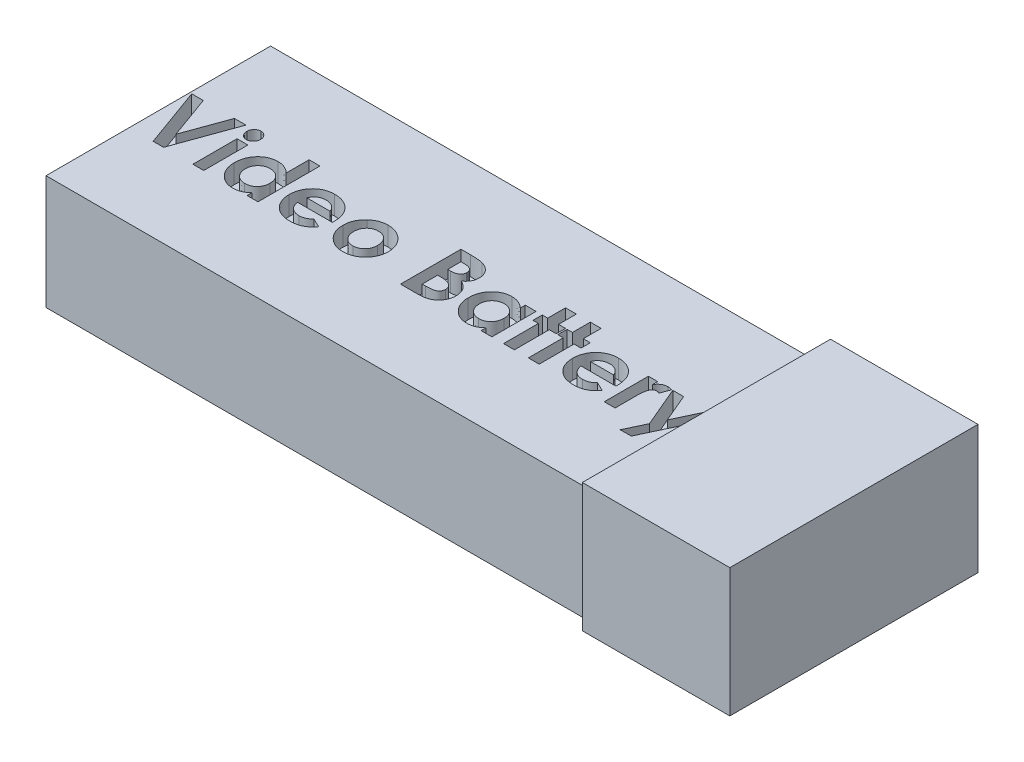
from build123d import *

# Parameters (mm, degrees)
SKETCH1_W           = 28.8
SKETCH1_H           = 11.8
BOSS_EXTRUDE1_DEPTH = 6
SKETCH3_W           = 13.04
SKETCH3_H           = 6.75
BOSS_EXTRUDE2_DEPTH = 7.75
SKETCH4_W           = 0.569871795
SKETCH4_H           = 2.320192307
CUT_EXTRUDE1_DEPTH  = 1


with BuildPart() as part:
    # Sketch1 → Boss-Extrude1 (new body)
    with BuildSketch(Plane(origin=(0, 0, 0), x_dir=(1, 0, 0), z_dir=(0, 1, 0))):
        with Locations((-14.4, 5.9)):
            Rectangle(SKETCH1_W, SKETCH1_H)
    extrude(amount=BOSS_EXTRUDE1_DEPTH)

    # Sketch3 → Boss-Extrude2 (add)
    with BuildSketch(Plane(origin=(0, 0, 0), x_dir=(0, 0, -1), z_dir=(1, 0, 0))):
        with Locations((5.9, 3.375)):
            Rectangle(SKETCH3_W, SKETCH3_H)
    extrude(amount=BOSS_EXTRUDE2_DEPTH)

    # Sketch4 → Cut-Extrude1 (cut)
    # profile 1 of 13: a face of its own
    with BuildSketch(Plane(origin=(0, 6, 0), x_dir=(1, 0, 0), z_dir=(0, 1, 0))):
        Polygon((-28.698237179, 7.554953492), (-28.089568309, 7.554953492), (-27.273557692, 5.299634982), (-26.455639022, 7.554953492), (-25.848878205, 7.554953492), (-27.000070112, 4.379953492), (-27.548953325, 4.379953492), align=None)
    # profile 2 of 13: a face of its own
    with BuildSketch(Plane(origin=(0, 6, 0), x_dir=(1, 0, 0), z_dir=(0, 1, 0))):
        with BuildLine():
            add(Edge.make_bspline(
                [(-25.178515625, 7.677068876), (-25.153954155, 7.675863798), (-25.105725341, 7.67349751), (-25.036631003, 7.650431464), (-24.973216404, 7.614229995), (-24.917156139, 7.564560717), (-24.870530453, 7.505246514), (-24.834906697, 7.43884032), (-24.815062187, 7.365264396), (-24.812306078, 7.314438917), (-24.810897436, 7.288462106)],
                knots=[0, 0, 0, 0, 0.989868614, 1.943702388, 2.910836514, 3.924849579, 4.949916355, 5.946401046, 6.950409252, 8, 8, 8, 8], degree=3))
            add(Edge.make_bspline(
                [(-24.810897436, 7.288462106), (-24.812255679, 7.262676729), (-24.814902282, 7.212432695), (-24.835363431, 7.139855599), (-24.869557373, 7.073481658), (-24.916560698, 7.015048381), (-24.972013196, 6.966179056), (-25.034042138, 6.929320371), (-25.102474352, 6.907537484), (-25.1499548, 6.904973388), (-25.174063502, 6.903671441)],
                knots=[0, 0, 0, 0, 1.05296456, 2.051751585, 3.055639087, 4.085634717, 5.099016424, 6.062201612, 7.016062274, 8, 8, 8, 8], degree=3))
            add(Edge.make_bspline(
                [(-25.174063502, 6.903671441), (-25.198839373, 6.904872211), (-25.247487775, 6.907229972), (-25.317148829, 6.930349987), (-25.381409218, 6.966266346), (-25.437226293, 7.016950444), (-25.484385947, 7.07668612), (-25.518453643, 7.144638307), (-25.53976383, 7.218717342), (-25.54229333, 7.270295581), (-25.543589744, 7.296730335)],
                knots=[0, 0, 0, 0, 0.989065327, 1.942068821, 2.907541208, 3.917690034, 4.939857478, 5.938239964, 6.943311734, 8, 8, 8, 8], degree=3))
            add(Edge.make_bspline(
                [(-25.543589744, 7.296730335), (-25.542178891, 7.32207786), (-25.539407476, 7.371869414), (-25.519444095, 7.44380953), (-25.484637191, 7.509099332), (-25.438347354, 7.567327733), (-25.382779487, 7.616070493), (-25.319402957, 7.651172499), (-25.250773626, 7.673285851), (-25.202850325, 7.675794848), (-25.178515625, 7.677068876)],
                knots=[0, 0, 0, 0, 1.038616768, 2.040212704, 3.031499824, 4.052181184, 5.074969369, 6.039807101, 7.004644834, 8, 8, 8, 8], degree=3))
        make_face()
    # profile 3 of 13: a face of its own
    with BuildSketch(Plane(origin=(0, 6, 0), x_dir=(1, 0, 0), z_dir=(0, 1, 0))):
        with Locations((-25.17724359, 5.540049645)):
            Rectangle(SKETCH4_W, SKETCH4_H)
    # profile 4 of 13: a face of its own
    with BuildSketch(Plane(origin=(0, 6, 0), x_dir=(1, 0, 0), z_dir=(0, 1, 0))):
        with BuildLine():
            Line((-22.612820513, 7.636363748), (-22.042948718, 7.636363748))
            Line((-22.042948718, 7.636363748), (-22.042948718, 4.379953492))
            Line((-22.042948718, 4.379953492), (-22.612820513, 4.379953492))
            Line((-22.612820513, 4.379953492), (-22.612820513, 4.633088508))
            add(Edge.make_bspline(
                [(-22.612820513, 4.633088508), (-22.64105745, 4.608448616), (-22.69585977, 4.560627451), (-22.782210492, 4.498578273), (-22.868813541, 4.447395722), (-22.956085047, 4.40663161), (-23.045366336, 4.37653151), (-23.137300198, 4.354738334), (-23.233210579, 4.341886365), (-23.298409134, 4.340136857), (-23.331520433, 4.339248364)],
                knots=[0, 0, 0, 0, 1.129196829, 2.191548051, 3.199897424, 4.157751732, 5.089409408, 6.034969131, 7.002052659, 8, 8, 8, 8], degree=3))
            add(Edge.make_bspline(
                [(-23.331520433, 4.339248364), (-23.368689338, 4.340084548), (-23.442137201, 4.341736895), (-23.549913786, 4.359130515), (-23.653982793, 4.385755328), (-23.754259748, 4.423432765), (-23.850562206, 4.472255338), (-23.943627172, 4.530949196), (-24.03185923, 4.601574846), (-24.115992881, 4.681076496), (-24.193025147, 4.768528876), (-24.260367481, 4.862718159), (-24.317132064, 4.96230848), (-24.36363625, 5.066969649), (-24.400217797, 5.176624851), (-24.426295205, 5.29162188), (-24.441680906, 5.412001806), (-24.443585223, 5.493999897), (-24.444551282, 5.535597522)],
                knots=[0, 0, 0, 0, 0.980476535, 1.937477201, 2.874147792, 3.812856188, 4.758993464, 5.720109578, 6.712210464, 7.737600662, 8.772720504, 9.783789959, 10.789002326, 11.793715968, 12.802552247, 13.835794126, 14.902098527, 16, 16, 16, 16], degree=3))
            add(Edge.make_bspline(
                [(-24.444551282, 5.535597522), (-24.443537399, 5.578671918), (-24.441548554, 5.663167145), (-24.427000275, 5.787159873), (-24.401404093, 5.905008243), (-24.366501859, 6.016875493), (-24.321606195, 6.12278095), (-24.266926275, 6.222898119), (-24.201718232, 6.316965311), (-24.126577522, 6.403381436), (-24.045444011, 6.482585989), (-23.958645497, 6.551539833), (-23.867539319, 6.610119333), (-23.772028661, 6.657942937), (-23.672127163, 6.694898598), (-23.568229234, 6.721916204), (-23.45987364, 6.738127716), (-23.386060931, 6.739935652), (-23.348692909, 6.740850928)],
                knots=[0, 0, 0, 0, 1.136281865, 2.228943489, 3.287578264, 4.313574083, 5.316051562, 6.317280042, 7.318008486, 8.329309503, 9.333984563, 10.305318864, 11.248632312, 12.186624717, 13.117503092, 14.05354244, 15.014596925, 16, 16, 16, 16], degree=3))
            add(Edge.make_bspline(
                [(-23.348692909, 6.740850928), (-23.314100327, 6.739753415), (-23.245693497, 6.737583083), (-23.144644824, 6.723921385), (-23.047416811, 6.698197599), (-22.952828624, 6.665054393), (-22.862108674, 6.620454941), (-22.774769563, 6.566880323), (-22.690581167, 6.503650155), (-22.639068416, 6.454753301), (-22.612820513, 6.429838307)],
                knots=[0, 0, 0, 0, 1.011899165, 2.001030639, 2.974036179, 3.948778736, 4.92769327, 5.924124564, 6.942254589, 8, 8, 8, 8], degree=3))
            Line((-22.612820513, 6.429838307), (-22.612820513, 7.636363748))
        make_face()
        with BuildLine():
            add(Edge.make_bspline(
                [(-23.229121595, 6.211684261), (-23.251829306, 6.21098751), (-23.296334937, 6.209621924), (-23.361786558, 6.201407826), (-23.424338673, 6.186934221), (-23.483545166, 6.165552576), (-23.54028843, 6.139506618), (-23.59370681, 6.106884485), (-23.644241184, 6.068325816), (-23.691594355, 6.024764117), (-23.734763747, 5.976881845), (-23.771978282, 5.924631912), (-23.803604625, 5.869422156), (-23.830352292, 5.811086582), (-23.849497552, 5.748934898), (-23.864660591, 5.68377621), (-23.872529226, 5.615078204), (-23.873955562, 5.568262638), (-23.874679487, 5.544501769)],
                knots=[0, 0, 0, 0, 1.04836806, 2.054732945, 3.03993516, 4.00574415, 4.955904794, 5.917688631, 6.888591924, 7.88601754, 8.884115178, 9.859153345, 10.841239365, 11.818093293, 12.814750328, 13.83810466, 14.90274714, 16, 16, 16, 16], degree=3))
            add(Edge.make_bspline(
                [(-23.874679487, 5.544501769), (-23.87396662, 5.520525375), (-23.872561924, 5.473280168), (-23.864533363, 5.404002669), (-23.849915953, 5.337892166), (-23.828589703, 5.275483115), (-23.802545405, 5.215933413), (-23.770843638, 5.159517888), (-23.731903569, 5.107234036), (-23.688696335, 5.057844646), (-23.640371721, 5.013741837), (-23.589551403, 4.974582593), (-23.535541215, 4.941818077), (-23.478927128, 4.915337589), (-23.41989971, 4.893758217), (-23.357718934, 4.879466515), (-23.29299394, 4.8703301), (-23.248869203, 4.869057795), (-23.226577524, 4.86841503)],
                knots=[0, 0, 0, 0, 1.099136573, 2.165835871, 3.191374663, 4.196217796, 5.183857741, 6.167377911, 7.154730987, 8.166690795, 9.170734848, 10.148332609, 11.103258353, 12.059567475, 13.009337315, 13.978056681, 14.978520572, 16, 16, 16, 16], degree=3))
            add(Edge.make_bspline(
                [(-23.226577524, 4.86841503), (-23.203446855, 4.869115687), (-23.15809817, 4.870489356), (-23.091578739, 4.878628491), (-23.028186324, 4.893155165), (-22.968184673, 4.914659224), (-22.910657317, 4.940518224), (-22.856123389, 4.972502896), (-22.805174664, 5.010973084), (-22.75755311, 5.054928582), (-22.713917136, 5.103201841), (-22.676187953, 5.156136949), (-22.643324454, 5.212040895), (-22.617478825, 5.272235453), (-22.59695377, 5.335667499), (-22.582227517, 5.402730705), (-22.574217289, 5.473497374), (-22.572824878, 5.521798383), (-22.572115385, 5.546409822)],
                knots=[0, 0, 0, 0, 1.050008698, 2.058587853, 3.036635738, 3.995319155, 4.947022481, 5.895997462, 6.858296291, 7.838991643, 8.833936038, 9.806048392, 10.784806122, 11.771666913, 12.772873988, 13.80724452, 14.882696879, 16, 16, 16, 16], degree=3))
            add(Edge.make_bspline(
                [(-22.572115385, 5.546409822), (-22.572816062, 5.570597956), (-22.574184688, 5.617844408), (-22.582262063, 5.687133502), (-22.597092864, 5.752879893), (-22.617195479, 5.815204432), (-22.643500911, 5.873964612), (-22.676389275, 5.928508926), (-22.71370459, 5.980727128), (-22.757823677, 6.02769626), (-22.805187254, 6.071333486), (-22.856885263, 6.108640307), (-22.911288935, 6.14079236), (-22.968732528, 6.167190436), (-23.029747944, 6.186541226), (-23.093248692, 6.201523835), (-23.160225516, 6.209616994), (-23.205781466, 6.210983927), (-23.229121595, 6.211684261)],
                knots=[0, 0, 0, 0, 1.106611376, 2.161533483, 3.185006901, 4.184773755, 5.152708835, 6.122342771, 7.094156588, 8.082475533, 9.064254463, 10.03606828, 10.992420271, 11.951521816, 12.920622147, 13.915721683, 14.932141191, 16, 16, 16, 16], degree=3))
        make_face(mode=Mode.SUBTRACT)
    # profile 5 of 13: a face of its own
    with BuildSketch(Plane(origin=(0, 6, 0), x_dir=(1, 0, 0), z_dir=(0, 1, 0))):
        with BuildLine():
            Line((-19.154792668, 5.397581697), (-20.984615385, 5.397581697))
            add(Edge.make_bspline(
                [(-20.984615385, 5.397581697), (-20.980884524, 5.376320195), (-20.973553088, 5.334539666), (-20.957632615, 5.273849823), (-20.937315703, 5.216656739), (-20.912967164, 5.162883962), (-20.884997513, 5.112247215), (-20.852373233, 5.064984004), (-20.815508132, 5.021136077), (-20.774615356, 4.980894), (-20.730376511, 4.944836227), (-20.683006141, 4.913247338), (-20.632455362, 4.887346382), (-20.579303719, 4.865514563), (-20.523154048, 4.848221551), (-20.463923711, 4.83629489), (-20.401769717, 4.829249767), (-20.359428518, 4.828230771), (-20.337785457, 4.827709902)],
                knots=[0, 0, 0, 0, 1.091296461, 2.144483647, 3.168565212, 4.157007626, 5.126487748, 6.090021542, 7.05641414, 8.019231907, 8.98705074, 9.938580405, 10.892824166, 11.854447369, 12.841318655, 13.858982407, 14.905600794, 16, 16, 16, 16], degree=3))
            add(Edge.make_bspline(
                [(-20.337785457, 4.827709902), (-20.311660813, 4.828399618), (-20.260213695, 4.829757872), (-20.184843284, 4.841803564), (-20.111949118, 4.859998052), (-20.042221032, 4.887054784), (-19.974851336, 4.920735659), (-19.910949142, 4.962697884), (-19.849408353, 5.011715187), (-19.811861219, 5.049497706), (-19.792718349, 5.068760583)],
                knots=[0, 0, 0, 0, 1.021034703, 2.010718019, 2.977989445, 3.954245119, 4.929443971, 5.918328161, 6.938689359, 8, 8, 8, 8], degree=3))
            Line((-19.792718349, 5.068760583), (-19.315705128, 4.84170229))
            add(Edge.make_bspline(
                [(-19.315705128, 4.84170229), (-19.330723611, 4.820949052), (-19.360482183, 4.779827273), (-19.409062052, 4.72195831), (-19.459758239, 4.66796422), (-19.512608553, 4.61820013), (-19.567680021, 4.572807849), (-19.624819448, 4.531234415), (-19.684861902, 4.49459606), (-19.746606847, 4.461120242), (-19.811330665, 4.432421578), (-19.878854235, 4.40794837), (-19.948891558, 4.385824799), (-20.022327053, 4.36896785), (-20.098549225, 4.355624026), (-20.177740411, 4.346148143), (-20.259890175, 4.340295345), (-20.315726891, 4.339601503), (-20.344145633, 4.339248364)],
                knots=[0, 0, 0, 0, 1.028154879, 2.037251081, 3.030720504, 4.000128189, 4.949298328, 5.894184978, 6.834267904, 7.770992897, 8.712077017, 9.673380525, 10.653304757, 11.658697181, 12.695551717, 13.758623199, 14.859225354, 16, 16, 16, 16], degree=3))
            add(Edge.make_bspline(
                [(-20.344145633, 4.339248364), (-20.387867401, 4.340139719), (-20.473493965, 4.341885387), (-20.598738292, 4.358087684), (-20.717685666, 4.38495284), (-20.830671951, 4.421471893), (-20.937208746, 4.469688484), (-21.037348776, 4.528661374), (-21.132092584, 4.597259935), (-21.218545216, 4.676923869), (-21.297306114, 4.763633325), (-21.36648479, 4.856753359), (-21.424372521, 4.955633377), (-21.47191109, 5.059618971), (-21.508859718, 5.168976303), (-21.535497535, 5.283753094), (-21.551826836, 5.403894525), (-21.553590481, 5.48572425), (-21.554487179, 5.527329293)],
                knots=[0, 0, 0, 0, 1.103565453, 2.161269334, 3.182010356, 4.179077853, 5.15417608, 6.128274628, 7.109042802, 8.101804412, 9.090965879, 10.063106201, 11.02526161, 11.978650795, 12.945248442, 13.93468508, 14.949922959, 16, 16, 16, 16], degree=3))
            add(Edge.make_bspline(
                [(-21.554487179, 5.527329293), (-21.553581656, 5.569991574), (-21.551800079, 5.653927694), (-21.53563813, 5.776843246), (-21.508786073, 5.894121307), (-21.471729363, 6.005923381), (-21.42491196, 6.112599139), (-21.366287707, 6.213215295), (-21.297340444, 6.308122139), (-21.21886328, 6.396875688), (-21.132044408, 6.476985462), (-21.039791154, 6.548379281), (-20.941066958, 6.607869349), (-20.836988476, 6.655937287), (-20.728221431, 6.694991274), (-20.613508629, 6.72097844), (-20.493722859, 6.738427267), (-20.411839944, 6.740034195), (-20.370222356, 6.740850928)],
                knots=[0, 0, 0, 0, 1.079208495, 2.12329425, 3.130605359, 4.119693003, 5.099659317, 6.073216462, 7.060498243, 8.06384408, 9.066070512, 10.045757761, 11.010926815, 11.975797609, 12.942977511, 13.929384301, 14.947594487, 16, 16, 16, 16], degree=3))
            add(Edge.make_bspline(
                [(-20.370222356, 6.740850928), (-20.32629113, 6.739945744), (-20.240036697, 6.738168508), (-20.113920081, 6.722097769), (-19.994182911, 6.695068793), (-19.88031504, 6.658865514), (-19.773770607, 6.609430921), (-19.672208508, 6.55190926), (-19.578064778, 6.481827889), (-19.490335945, 6.402553805), (-19.411142744, 6.314601956), (-19.341919111, 6.219059311), (-19.28301832, 6.116858308), (-19.235278644, 6.007584503), (-19.198367956, 5.891565944), (-19.171705481, 5.768953306), (-19.155500733, 5.639280228), (-19.153769905, 5.55048564), (-19.152884615, 5.505068676)],
                knots=[0, 0, 0, 0, 1.080001299, 2.120471247, 3.119684163, 4.095710327, 5.052285597, 6.002875087, 6.961153713, 7.931888285, 8.906493152, 9.865905668, 10.82813294, 11.801621613, 12.7925306, 13.817193356, 14.883530496, 16, 16, 16, 16], degree=3))
            Line((-19.152884615, 5.505068676), (-19.154792668, 5.397581697))
        make_face()
        with BuildLine():
            add(Edge.make_bspline(
                [(-19.72275641, 5.845338107), (-19.73351024, 5.874358336), (-19.754891654, 5.932058112), (-19.803191378, 6.011669723), (-19.867283567, 6.080616611), (-19.941827381, 6.141655838), (-20.026998356, 6.191199088), (-20.120112605, 6.227070009), (-20.219993183, 6.248578664), (-20.288705638, 6.251101251), (-20.323793069, 6.252389389)],
                knots=[0, 0, 0, 0, 0.954238005, 1.897273737, 2.851915805, 3.847685534, 4.862635127, 5.880135777, 6.917509367, 8, 8, 8, 8], degree=3))
            add(Edge.make_bspline(
                [(-20.323793069, 6.252389389), (-20.362114256, 6.251151976), (-20.437024198, 6.248733091), (-20.545076688, 6.22300736), (-20.646999899, 6.184612476), (-20.707088047, 6.145026535), (-20.737204527, 6.125185864)],
                knots=[0, 0, 0, 0, 1.044195649, 2.041185066, 3.018232172, 4, 4, 4, 4], degree=3))
            add(Edge.make_bspline(
                [(-20.737204527, 6.125185864), (-20.755994962, 6.110074774), (-20.796055207, 6.077858702), (-20.848081563, 6.013590699), (-20.899327956, 5.935776574), (-20.928464356, 5.876671249), (-20.943910256, 5.845338107)],
                knots=[0, 0, 0, 0, 0.82159062, 1.751589201, 2.808063854, 4, 4, 4, 4], degree=3))
            Line((-20.943910256, 5.845338107), (-19.72275641, 5.845338107))
        make_face(mode=Mode.SUBTRACT)
    # profile 6 of 13: a face of its own
    with BuildSketch(Plane(origin=(0, 6, 0), x_dir=(1, 0, 0), z_dir=(0, 1, 0))):
        with BuildLine():
            add(Edge.make_bspline(
                [(-17.559024439, 6.740850928), (-17.532082001, 6.740371469), (-17.478723765, 6.739421922), (-17.399253338, 6.731517816), (-17.321172237, 6.718621941), (-17.244031663, 6.701924034), (-17.168547938, 6.678527769), (-17.094325159, 6.650467567), (-17.020699679, 6.618251173), (-16.94949887, 6.579902396), (-16.880208357, 6.53830965), (-16.814516827, 6.492429439), (-16.752969803, 6.442622135), (-16.694424762, 6.390042561), (-16.641609999, 6.332401573), (-16.591150365, 6.272476555), (-16.545772073, 6.208120605), (-16.503758311, 6.140901927), (-16.466353761, 6.071209234), (-16.433874788, 5.999527332), (-16.405686093, 5.926847276), (-16.38361491, 5.852283771), (-16.365342005, 5.776820038), (-16.353810503, 5.699531324), (-16.345612405, 5.621211579), (-16.344693138, 5.568480281), (-16.344230769, 5.541957699)],
                knots=[0, 0, 0, 0, 1.022364134, 2.024744242, 3.027414945, 4.024939316, 5.017584196, 6.023349371, 7.035562955, 8.064994934, 9.090267829, 10.101425541, 11.102933353, 12.093946398, 13.084502048, 14.067315274, 15.065326281, 16.070028806, 17.074376865, 18.064572984, 19.055292013, 20.030201733, 21.013838017, 21.999348303, 22.993720005, 24, 24, 24, 24], degree=3))
            add(Edge.make_bspline(
                [(-16.344230769, 5.541957699), (-16.344718723, 5.515227908), (-16.345688887, 5.462083026), (-16.353513906, 5.383026586), (-16.366459142, 5.30537442), (-16.383221137, 5.228669063), (-16.406529846, 5.153892036), (-16.433763585, 5.079941094), (-16.467194072, 5.007824217), (-16.504153938, 4.936754678), (-16.54643783, 4.868823836), (-16.591776843, 4.803823195), (-16.642025126, 4.743458025), (-16.694417093, 4.685856236), (-16.751437813, 4.632965662), (-16.812177128, 4.5839275), (-16.876109204, 4.538142239), (-16.943693781, 4.496684086), (-17.014065214, 4.460256285), (-17.0860367, 4.42741365), (-17.16002909, 4.400069812), (-17.235889253, 4.377771664), (-17.313663193, 4.360506767), (-17.393179208, 4.348778516), (-17.474266049, 4.340621654), (-17.52889917, 4.339709074), (-17.556480369, 4.339248364)],
                knots=[0, 0, 0, 0, 1.012026251, 2.012137606, 3.004615893, 3.992048833, 4.982446996, 5.968083444, 6.973977695, 7.990229942, 8.999482246, 10.001782172, 10.988562221, 11.971415814, 12.948383116, 13.930088534, 14.925840678, 15.924049238, 16.929462851, 17.924729459, 18.917889337, 19.913673841, 20.916777188, 21.931792057, 22.95587778, 24, 24, 24, 24], degree=3))
            add(Edge.make_bspline(
                [(-17.556480369, 4.339248364), (-17.596809706, 4.340432109), (-17.676299443, 4.34276529), (-17.793369034, 4.358746966), (-17.905834265, 4.386255621), (-18.013878397, 4.42460208), (-18.117641783, 4.473741638), (-18.216218858, 4.534559302), (-18.310590196, 4.605857749), (-18.399121214, 4.687034356), (-18.480227619, 4.776092445), (-18.551083823, 4.871161413), (-18.611246474, 4.970816335), (-18.660661443, 5.075170851), (-18.698799724, 5.18436806), (-18.726342069, 5.298081501), (-18.742343285, 5.416630804), (-18.744656732, 5.497176621), (-18.745833333, 5.538141593)],
                knots=[0, 0, 0, 0, 1.029999031, 2.030143771, 3.011211297, 3.982305373, 4.953580601, 5.938004764, 6.935448627, 7.970290061, 9.001484052, 10.007591832, 10.993831261, 11.969999897, 12.951306496, 13.942897864, 14.953773953, 16, 16, 16, 16], degree=3))
            add(Edge.make_bspline(
                [(-18.745833333, 5.538141593), (-18.744615701, 5.581883203), (-18.742222468, 5.667856462), (-18.723219145, 5.793809245), (-18.692872888, 5.914403066), (-18.649312748, 6.029300585), (-18.593668501, 6.138713715), (-18.525739486, 6.242411693), (-18.445189993, 6.340418006), (-18.383505211, 6.399695584), (-18.352138421, 6.429838307)],
                knots=[0, 0, 0, 0, 1.043912699, 2.05178951, 3.033892, 4.007821512, 4.978932272, 5.95884105, 6.962068106, 8, 8, 8, 8], degree=3))
            add(Edge.make_bspline(
                [(-18.352138421, 6.429838307), (-18.323356257, 6.454823234), (-18.266575005, 6.504113323), (-18.174324158, 6.56662972), (-18.0798697, 6.620624814), (-17.982079555, 6.665018824), (-17.880681108, 6.698491191), (-17.776193968, 6.722856079), (-17.668639863, 6.737821708), (-17.595748598, 6.739836056), (-17.559024439, 6.740850928)],
                knots=[0, 0, 0, 0, 1.048115528, 2.067714963, 3.060638214, 4.039924844, 5.017819947, 5.994373833, 6.98952318, 8, 8, 8, 8], degree=3))
        make_face()
        with BuildLine():
            add(Edge.make_bspline(
                [(-17.546304087, 6.211684261), (-17.568367959, 6.210950931), (-17.611800928, 6.209507363), (-17.675735401, 6.201760119), (-17.736205298, 6.185881476), (-17.794411665, 6.165688189), (-17.849324825, 6.138682513), (-17.902448655, 6.107079648), (-17.951020832, 6.067532551), (-17.997391919, 6.024152279), (-18.039486529, 5.975979651), (-18.075355135, 5.923495609), (-18.107404528, 5.868708083), (-18.131705958, 5.809611232), (-18.151817714, 5.747820345), (-18.16542911, 5.68233707), (-18.174901691, 5.61389289), (-18.175604896, 5.567008157), (-18.175961538, 5.543229734)],
                knots=[0, 0, 0, 0, 1.030650113, 2.02884584, 2.99876339, 3.944280128, 4.900564847, 5.851248946, 6.823638398, 7.81794922, 8.81432732, 9.802856497, 10.78262424, 11.771747962, 12.779760563, 13.812642396, 14.89064281, 16, 16, 16, 16], degree=3))
            add(Edge.make_bspline(
                [(-18.175961538, 5.543229734), (-18.175544218, 5.518612763), (-18.174728645, 5.470503623), (-18.166283216, 5.400257807), (-18.152356424, 5.333594994), (-18.132570819, 5.270618163), (-18.107687079, 5.210875274), (-18.077157615, 5.154701524), (-18.040660224, 5.102434666), (-17.999281041, 5.054139061), (-17.953972603, 5.010300606), (-17.904327159, 4.972680084), (-17.852423673, 4.939992844), (-17.797066007, 4.913739945), (-17.739040398, 4.893470577), (-17.678174593, 4.878546923), (-17.614148741, 4.870506782), (-17.570493229, 4.869121868), (-17.548212139, 4.86841503)],
                knots=[0, 0, 0, 0, 1.141730614, 2.231293227, 3.276944405, 4.297399982, 5.28939179, 6.275415646, 7.257752684, 8.24146775, 9.222424823, 10.176631434, 11.126518621, 12.063689483, 13.012557477, 13.974037417, 14.965980454, 16, 16, 16, 16], degree=3))
            add(Edge.make_bspline(
                [(-17.548212139, 4.86841503), (-17.525919906, 4.869041964), (-17.482214189, 4.870271117), (-17.418113151, 4.879475535), (-17.35693652, 4.893961476), (-17.298415327, 4.914405295), (-17.243022721, 4.941220123), (-17.190546655, 4.974063744), (-17.14052549, 5.012207533), (-17.094609008, 5.056873136), (-17.052105, 5.105319358), (-17.014831526, 5.157862129), (-16.983684406, 5.214035893), (-16.95813819, 5.273487203), (-16.938313797, 5.336134345), (-16.924617567, 5.402210168), (-16.915139922, 5.471509901), (-16.91445262, 5.519027876), (-16.914102564, 5.543229734)],
                knots=[0, 0, 0, 0, 1.031504075, 2.022346795, 2.991027682, 3.937587355, 4.885570121, 5.833146507, 6.798790848, 7.791235734, 8.792807298, 9.778388351, 10.766749885, 11.760164525, 12.768777521, 13.802286646, 14.880660483, 16, 16, 16, 16], degree=3))
            add(Edge.make_bspline(
                [(-16.914102564, 5.543229734), (-16.914525194, 5.567423133), (-16.91535453, 5.614898432), (-16.923800561, 5.684291891), (-16.937590678, 5.750154139), (-16.957631475, 5.81220395), (-16.982367309, 5.871149213), (-17.012917874, 5.92668821), (-17.049595259, 5.978547398), (-17.091175598, 6.026469628), (-17.137163238, 6.06969293), (-17.185946717, 6.108237622), (-17.238641565, 6.140117044), (-17.294259194, 6.166397068), (-17.352947575, 6.186615795), (-17.414640822, 6.201624025), (-17.479528006, 6.209549759), (-17.523812763, 6.210965324), (-17.546304087, 6.211684261)],
                knots=[0, 0, 0, 0, 1.123894411, 2.205445421, 3.243160173, 4.246488011, 5.231014757, 6.210004299, 7.185865357, 8.177612767, 9.153374344, 10.115157457, 11.061423229, 12.009021698, 12.96873347, 13.94135618, 14.954456845, 16, 16, 16, 16], degree=3))
        make_face(mode=Mode.SUBTRACT)
    # profile 7 of 13: a face of its own
    with BuildSketch(Plane(origin=(0, 6, 0), x_dir=(1, 0, 0), z_dir=(0, 1, 0))):
        with BuildLine():
            Line((-14.553205128, 4.379953492), (-14.553205128, 7.554953492))
            Line((-14.553205128, 7.554953492), (-14.044391026, 7.554953492))
            add(Edge.make_bspline(
                [(-14.044391026, 7.554953492), (-14.008770857, 7.554957557), (-13.939846506, 7.554965423), (-13.840406655, 7.551473422), (-13.748184591, 7.546956127), (-13.663473801, 7.541902325), (-13.5861301, 7.533193614), (-13.516271104, 7.524015584), (-13.453757232, 7.512947445), (-13.415108302, 7.503018982), (-13.39692508, 7.498347923)],
                knots=[0, 0, 0, 0, 1.311965854, 2.538629056, 3.664479157, 4.713267157, 5.663616078, 6.530575999, 7.308677837, 8, 8, 8, 8], degree=3))
            add(Edge.make_bspline(
                [(-13.39692508, 7.498347923), (-13.373048664, 7.491759311), (-13.326195471, 7.478830338), (-13.259086747, 7.452719719), (-13.195424761, 7.423695915), (-13.135287243, 7.390585183), (-13.079043461, 7.352987783), (-13.02690716, 7.310605332), (-12.97775389, 7.265139059), (-12.93332897, 7.215321832), (-12.893176163, 7.162680703), (-12.858290572, 7.107229466), (-12.827979465, 7.049816007), (-12.80372264, 6.989717816), (-12.785445578, 6.92721166), (-12.772077812, 6.862564451), (-12.763413688, 6.795571628), (-12.762595042, 6.749994222), (-12.762179487, 6.72685854)],
                knots=[0, 0, 0, 0, 1.099996261, 2.158545794, 3.195537121, 4.207578794, 5.205712374, 6.197378256, 7.190519799, 8.17788031, 9.159561366, 10.129234751, 11.085776129, 12.040971148, 13.00380137, 13.975669004, 14.972423361, 16, 16, 16, 16], degree=3))
            add(Edge.make_bspline(
                [(-12.762179487, 6.72685854), (-12.763266041, 6.697135261), (-12.765404788, 6.638628639), (-12.779067253, 6.552692997), (-12.804686502, 6.471471463), (-12.838208666, 6.393467155), (-12.883788329, 6.31897103), (-12.941665686, 6.248018509), (-13.010903313, 6.178424857), (-13.064012395, 6.136708157), (-13.091636619, 6.115009582)],
                knots=[0, 0, 0, 0, 0.986156485, 1.941127874, 2.875419072, 3.804401753, 4.751181392, 5.761612777, 6.835722519, 8, 8, 8, 8], degree=3))
            add(Edge.make_bspline(
                [(-13.091636619, 6.115009582), (-13.069251273, 6.103582057), (-13.025359804, 6.081175843), (-12.963046813, 6.044346715), (-12.905351785, 6.005174267), (-12.852016034, 5.964446664), (-12.804158337, 5.920437404), (-12.75980257, 5.87568236), (-12.721137017, 5.827617255), (-12.686561114, 5.777955222), (-12.656508301, 5.725977147), (-12.630335615, 5.67177081), (-12.608228486, 5.61515103), (-12.589507597, 5.556405957), (-12.575545553, 5.495333534), (-12.566442004, 5.43191192), (-12.559471757, 5.366357414), (-12.558929538, 5.321703322), (-12.558653846, 5.298998965)],
                knots=[0, 0, 0, 0, 1.164658916, 2.283573913, 3.35186032, 4.395461096, 5.390182219, 6.362969632, 7.312859996, 8.245001507, 9.165155236, 10.092416118, 11.032087915, 11.979892451, 12.947605196, 13.931445124, 14.948243989, 16, 16, 16, 16], degree=3))
            add(Edge.make_bspline(
                [(-12.558653846, 5.298998965), (-12.560442899, 5.25563494), (-12.563973588, 5.17005621), (-12.589788262, 5.044406981), (-12.634542704, 4.925280115), (-12.694638691, 4.813149074), (-12.768688509, 4.711259867), (-12.853824565, 4.622005807), (-12.949189734, 4.546454226), (-13.037175628, 4.49546277), (-13.113276498, 4.461242735), (-13.176309427, 4.440085751), (-13.244005456, 4.420485953), (-13.317604615, 4.40672257), (-13.395772651, 4.394124809), (-13.479271707, 4.38634669), (-13.567945724, 4.381075651), (-13.628850873, 4.380335107), (-13.660236378, 4.379953492)],
                knots=[0, 0, 0, 0, 1.284142165, 2.534249414, 3.780121997, 5.041676246, 6.291546858, 7.49970053, 8.684500223, 9.883330709, 10.50184324, 11.153274765, 11.851151195, 12.587658647, 13.369265475, 14.195992086, 15.070362669, 16, 16, 16, 16], degree=3))
            Line((-13.660236378, 4.379953492), (-14.553205128, 4.379953492))
        make_face()
        with BuildLine():
            Line((-13.983333333, 6.985081697), (-13.983333333, 6.293094517))
            Line((-13.983333333, 6.293094517), (-13.831961138, 6.293094517))
            add(Edge.make_bspline(
                [(-13.831961138, 6.293094517), (-13.811388296, 6.29327392), (-13.771673671, 6.293620247), (-13.714310108, 6.298080813), (-13.660971257, 6.305690815), (-13.611859423, 6.316308683), (-13.566517111, 6.329791827), (-13.525233979, 6.346014952), (-13.488191544, 6.365808929), (-13.445156801, 6.395292931), (-13.399665974, 6.43867996), (-13.359620911, 6.501361512), (-13.336034637, 6.573445059), (-13.333407762, 6.624283958), (-13.332051282, 6.650536424)],
                knots=[0, 0, 0, 0, 1.065314748, 2.056525647, 2.977365736, 3.853934255, 4.656397591, 5.425096493, 6.14721249, 6.826394842, 8.123232004, 9.372140726, 10.643011755, 12, 12, 12, 12], degree=3))
            add(Edge.make_bspline(
                [(-13.332051282, 6.650536424), (-13.333136714, 6.675126221), (-13.335235354, 6.722669605), (-13.3589837, 6.789424751), (-13.395869576, 6.848583472), (-13.439418538, 6.889072778), (-13.480428348, 6.916725781), (-13.515543463, 6.934934106), (-13.554084939, 6.951234012), (-13.596798898, 6.963697317), (-13.643441418, 6.973049343), (-13.693785932, 6.979917286), (-13.747919301, 6.9845919), (-13.785309334, 6.984914929), (-13.80461238, 6.985081697)],
                knots=[0, 0, 0, 0, 1.347982417, 2.606269829, 3.849316587, 5.153353503, 5.842674298, 6.568177932, 7.326619318, 8.142485038, 9.012069166, 9.942760135, 10.937925643, 12, 12, 12, 12], degree=3))
            Line((-13.80461238, 6.985081697), (-13.983333333, 6.985081697))
        make_face(mode=Mode.SUBTRACT)
        with BuildLine():
            Line((-13.983333333, 5.763927851), (-13.983333333, 4.949825287))
            Line((-13.983333333, 4.949825287), (-13.819240785, 4.949825287))
            add(Edge.make_bspline(
                [(-13.819240785, 4.949825287), (-13.78679948, 4.950010623), (-13.724427021, 4.950366954), (-13.635078585, 4.954672287), (-13.55383852, 4.962431889), (-13.48092208, 4.972119129), (-13.416217582, 4.985243823), (-13.35994374, 5.001930189), (-13.311328834, 5.020288098), (-13.270664359, 5.042962296), (-13.237443813, 5.069349439), (-13.207465753, 5.096317734), (-13.183023511, 5.127428209), (-13.163684353, 5.161345379), (-13.146946346, 5.197226716), (-13.136851162, 5.236473375), (-13.129165044, 5.277922177), (-13.128742056, 5.306591418), (-13.128525641, 5.321259582)],
                knots=[0, 0, 0, 0, 1.753078804, 3.370512758, 4.83203934, 6.162291463, 7.344201807, 8.395507345, 9.331626367, 10.147333109, 10.898971645, 11.62040215, 12.321813352, 13.025280112, 13.727906689, 14.453419512, 15.208716525, 16, 16, 16, 16], degree=3))
            add(Edge.make_bspline(
                [(-13.128525641, 5.321259582), (-13.129002898, 5.338032858), (-13.129932467, 5.370702687), (-13.137524264, 5.41845313), (-13.151321039, 5.463031337), (-13.16869875, 5.505577232), (-13.192880758, 5.544567524), (-13.221620249, 5.581351521), (-13.256344891, 5.614683601), (-13.295394776, 5.646579814), (-13.340942601, 5.674506676), (-13.393009736, 5.698738176), (-13.451879036, 5.718975432), (-13.517732858, 5.735088349), (-13.590282501, 5.748763159), (-13.6700575, 5.75692853), (-13.75639346, 5.763001475), (-13.816260219, 5.763612042), (-13.847225561, 5.763927851)],
                knots=[0, 0, 0, 0, 0.845221588, 1.646264278, 2.427170338, 3.19324141, 3.95557735, 4.731569926, 5.540061037, 6.376114724, 7.268642756, 8.224665384, 9.265483498, 10.400594375, 11.639216012, 12.983232105, 14.439614077, 16, 16, 16, 16], degree=3))
            Line((-13.847225561, 5.763927851), (-13.983333333, 5.763927851))
        make_face(mode=Mode.SUBTRACT)
    # profile 8 of 13: a face of its own
    with BuildSketch(Plane(origin=(0, 6, 0), x_dir=(1, 0, 0), z_dir=(0, 1, 0))):
        with BuildLine():
            Line((-10.319871795, 6.700145799), (-9.75, 6.700145799))
            Line((-9.75, 6.700145799), (-9.75, 4.379953492))
            Line((-9.75, 4.379953492), (-10.319871795, 4.379953492))
            Line((-10.319871795, 4.379953492), (-10.319871795, 4.633088508))
            add(Edge.make_bspline(
                [(-10.319871795, 4.633088508), (-10.348108732, 4.608448616), (-10.402911052, 4.560627451), (-10.489261774, 4.498578273), (-10.575864823, 4.447395722), (-10.663136329, 4.40663161), (-10.752417618, 4.37653151), (-10.84435148, 4.354738334), (-10.940261861, 4.341886365), (-11.005460416, 4.340136857), (-11.038571715, 4.339248364)],
                knots=[0, 0, 0, 0, 1.129196829, 2.191548051, 3.199897424, 4.157751732, 5.089409408, 6.034969131, 7.002052659, 8, 8, 8, 8], degree=3))
            add(Edge.make_bspline(
                [(-11.038571715, 4.339248364), (-11.07574062, 4.340084548), (-11.149188483, 4.341736895), (-11.256965068, 4.359130515), (-11.361034075, 4.385755328), (-11.46131103, 4.423432765), (-11.557613488, 4.472255338), (-11.650678454, 4.530949196), (-11.738910512, 4.601574846), (-11.823044163, 4.681076496), (-11.900076429, 4.768528876), (-11.967418763, 4.862718159), (-12.024183346, 4.96230848), (-12.070687532, 5.066969649), (-12.107269079, 5.176624851), (-12.133346487, 5.29162188), (-12.148732188, 5.412001806), (-12.150636505, 5.493999897), (-12.151602564, 5.535597522)],
                knots=[0, 0, 0, 0, 0.980476535, 1.937477201, 2.874147792, 3.812856188, 4.758993464, 5.720109578, 6.712210464, 7.737600662, 8.772720504, 9.783789959, 10.789002326, 11.793715968, 12.802552247, 13.835794126, 14.902098527, 16, 16, 16, 16], degree=3))
            add(Edge.make_bspline(
                [(-12.151602564, 5.535597522), (-12.150588681, 5.578671918), (-12.148599836, 5.663167145), (-12.134051557, 5.787159873), (-12.108455375, 5.905008243), (-12.073553141, 6.016875493), (-12.028657477, 6.12278095), (-11.973977557, 6.222898119), (-11.908769514, 6.316965311), (-11.833628804, 6.403381436), (-11.752495293, 6.482585989), (-11.665696779, 6.551539833), (-11.574590601, 6.610119333), (-11.479079943, 6.657942937), (-11.379178445, 6.694898598), (-11.275280516, 6.721916204), (-11.166924922, 6.738127716), (-11.093112213, 6.739935652), (-11.055744191, 6.740850928)],
                knots=[0, 0, 0, 0, 1.136281865, 2.228943489, 3.287578264, 4.313574083, 5.316051562, 6.317280042, 7.318008486, 8.329309503, 9.333984563, 10.305318864, 11.248632312, 12.186624717, 13.117503092, 14.05354244, 15.014596925, 16, 16, 16, 16], degree=3))
            add(Edge.make_bspline(
                [(-11.055744191, 6.740850928), (-11.021129294, 6.740131796), (-10.95263889, 6.738708894), (-10.851967864, 6.723258896), (-10.754331489, 6.699891871), (-10.660262375, 6.666598067), (-10.568988937, 6.624557866), (-10.482081136, 6.571878361), (-10.397637785, 6.510773647), (-10.346114063, 6.463049572), (-10.319871795, 6.438742554)],
                knots=[0, 0, 0, 0, 1.017011718, 2.012299608, 2.98747302, 3.965332399, 4.941441765, 5.936729654, 6.94912688, 8, 8, 8, 8], degree=3))
            Line((-10.319871795, 6.438742554), (-10.319871795, 6.700145799))
        make_face()
        with BuildLine():
            add(Edge.make_bspline(
                [(-10.936172877, 6.211684261), (-10.958880588, 6.21098751), (-11.003386219, 6.209621924), (-11.06883784, 6.201407826), (-11.131389955, 6.186934221), (-11.190596448, 6.165552576), (-11.247339712, 6.139506618), (-11.300758092, 6.106884485), (-11.351292466, 6.068325816), (-11.398645637, 6.024764117), (-11.441815029, 5.976881845), (-11.479029564, 5.924631912), (-11.510655907, 5.869422156), (-11.537403574, 5.811086582), (-11.556548834, 5.748934898), (-11.571711873, 5.68377621), (-11.579580508, 5.615078204), (-11.581006844, 5.568262638), (-11.581730769, 5.544501769)],
                knots=[0, 0, 0, 0, 1.04836806, 2.054732945, 3.03993516, 4.00574415, 4.955904794, 5.917688631, 6.888591924, 7.88601754, 8.884115178, 9.859153345, 10.841239365, 11.818093293, 12.814750328, 13.83810466, 14.90274714, 16, 16, 16, 16], degree=3))
            add(Edge.make_bspline(
                [(-11.581730769, 5.544501769), (-11.581017902, 5.520525375), (-11.579613206, 5.473280168), (-11.571584645, 5.404002669), (-11.556967235, 5.337892166), (-11.535640985, 5.275483115), (-11.509596688, 5.215933413), (-11.47789492, 5.159517888), (-11.438954852, 5.107234036), (-11.395747617, 5.057844646), (-11.347423004, 5.013741837), (-11.296602685, 4.974582593), (-11.242592497, 4.941818077), (-11.18597841, 4.915337589), (-11.126950992, 4.893758217), (-11.064770216, 4.879466515), (-11.000045223, 4.8703301), (-10.955920485, 4.869057795), (-10.933628806, 4.86841503)],
                knots=[0, 0, 0, 0, 1.099136573, 2.165835871, 3.191374663, 4.196217796, 5.183857741, 6.167377911, 7.154730987, 8.166690795, 9.170734848, 10.148332609, 11.103258353, 12.059567475, 13.009337315, 13.978056681, 14.978520572, 16, 16, 16, 16], degree=3))
            add(Edge.make_bspline(
                [(-10.933628806, 4.86841503), (-10.910498137, 4.869115687), (-10.865149452, 4.870489356), (-10.798630021, 4.878628491), (-10.735237606, 4.893155165), (-10.675235955, 4.914659224), (-10.617708599, 4.940518224), (-10.563174671, 4.972502896), (-10.512225946, 5.010973084), (-10.464604392, 5.054928582), (-10.420968418, 5.103201841), (-10.383239235, 5.156136949), (-10.350375736, 5.212040895), (-10.324530107, 5.272235453), (-10.304005052, 5.335667499), (-10.289278799, 5.402730705), (-10.281268571, 5.473497374), (-10.27987616, 5.521798383), (-10.279166667, 5.546409822)],
                knots=[0, 0, 0, 0, 1.050008698, 2.058587853, 3.036635738, 3.995319155, 4.947022481, 5.895997462, 6.858296291, 7.838991643, 8.833936038, 9.806048392, 10.784806122, 11.771666913, 12.772873988, 13.80724452, 14.882696879, 16, 16, 16, 16], degree=3))
            add(Edge.make_bspline(
                [(-10.279166667, 5.546409822), (-10.279867344, 5.570597956), (-10.28123597, 5.617844408), (-10.289313345, 5.687133502), (-10.304144146, 5.752879893), (-10.324246761, 5.815204432), (-10.350552193, 5.873964612), (-10.383440557, 5.928508926), (-10.420755872, 5.980727128), (-10.464874959, 6.02769626), (-10.512238536, 6.071333486), (-10.563936545, 6.108640307), (-10.618340217, 6.14079236), (-10.67578381, 6.167190436), (-10.736799226, 6.186541226), (-10.800299974, 6.201523835), (-10.867276798, 6.209616994), (-10.912832748, 6.210983927), (-10.936172877, 6.211684261)],
                knots=[0, 0, 0, 0, 1.106611376, 2.161533483, 3.185006901, 4.184773755, 5.152708835, 6.122342771, 7.094156588, 8.082475533, 9.064254463, 10.03606828, 10.992420271, 11.951521816, 12.920622147, 13.915721683, 14.932141191, 16, 16, 16, 16], degree=3))
        make_face(mode=Mode.SUBTRACT)
    # profile 9 of 13: a face of its own
    with BuildSketch(Plane(origin=(0, 6, 0), x_dir=(1, 0, 0), z_dir=(0, 1, 0))):
        Polygon((-9.139423077, 7.636363748), (-8.569551282, 7.636363748), (-8.569551282, 6.700145799), (-8.203205128, 6.700145799), (-8.203205128, 6.211684261), (-8.569551282, 6.211684261), (-8.569551282, 4.379953492), (-9.139423077, 4.379953492), (-9.139423077, 6.211684261), (-9.424358974, 6.211684261), (-9.424358974, 6.700145799), (-9.139423077, 6.700145799), align=None)
    # profile 10 of 13: a face of its own
    with BuildSketch(Plane(origin=(0, 6, 0), x_dir=(1, 0, 0), z_dir=(0, 1, 0))):
        Polygon((-7.836858974, 7.636363748), (-7.266987179, 7.636363748), (-7.266987179, 6.700145799), (-6.900641026, 6.700145799), (-6.900641026, 6.211684261), (-7.266987179, 6.211684261), (-7.266987179, 4.379953492), (-7.836858974, 4.379953492), (-7.836858974, 6.211684261), (-8.121794872, 6.211684261), (-8.121794872, 6.700145799), (-7.836858974, 6.700145799), align=None)
    # profile 11 of 13: a face of its own
    with BuildSketch(Plane(origin=(0, 6, 0), x_dir=(1, 0, 0), z_dir=(0, 1, 0))):
        with BuildLine():
            Line((-4.256715745, 5.397581697), (-6.086538462, 5.397581697))
            add(Edge.make_bspline(
                [(-6.086538462, 5.397581697), (-6.082807601, 5.376320195), (-6.075476165, 5.334539666), (-6.059555692, 5.273849823), (-6.03923878, 5.216656739), (-6.014890241, 5.162883962), (-5.98692059, 5.112247215), (-5.95429631, 5.064984004), (-5.917431209, 5.021136077), (-5.876538433, 4.980894), (-5.832299588, 4.944836227), (-5.784929218, 4.913247338), (-5.734378439, 4.887346382), (-5.681226796, 4.865514563), (-5.625077125, 4.848221551), (-5.565846788, 4.83629489), (-5.503692794, 4.829249767), (-5.461351595, 4.828230771), (-5.439708534, 4.827709902)],
                knots=[0, 0, 0, 0, 1.091296461, 2.144483647, 3.168565212, 4.157007626, 5.126487748, 6.090021542, 7.05641414, 8.019231907, 8.98705074, 9.938580405, 10.892824166, 11.854447369, 12.841318655, 13.858982407, 14.905600794, 16, 16, 16, 16], degree=3))
            add(Edge.make_bspline(
                [(-5.439708534, 4.827709902), (-5.41358389, 4.828399618), (-5.362136772, 4.829757872), (-5.286766361, 4.841803564), (-5.213872195, 4.859998052), (-5.144144109, 4.887054784), (-5.076774413, 4.920735659), (-5.012872219, 4.962697884), (-4.95133143, 5.011715187), (-4.913784296, 5.049497706), (-4.894641426, 5.068760583)],
                knots=[0, 0, 0, 0, 1.021034703, 2.010718019, 2.977989445, 3.954245119, 4.929443971, 5.918328161, 6.938689359, 8, 8, 8, 8], degree=3))
            Line((-4.894641426, 5.068760583), (-4.417628205, 4.84170229))
            add(Edge.make_bspline(
                [(-4.417628205, 4.84170229), (-4.432646688, 4.820949052), (-4.462405259, 4.779827273), (-4.510985129, 4.72195831), (-4.561681316, 4.66796422), (-4.61453163, 4.61820013), (-4.669603098, 4.572807849), (-4.726742524, 4.531234415), (-4.786784979, 4.49459606), (-4.848529924, 4.461120242), (-4.913253742, 4.432421578), (-4.980777312, 4.40794837), (-5.050814635, 4.385824799), (-5.12425013, 4.36896785), (-5.200472302, 4.355624026), (-5.279663488, 4.346148143), (-5.361813252, 4.340295345), (-5.417649968, 4.339601503), (-5.44606871, 4.339248364)],
                knots=[0, 0, 0, 0, 1.028154879, 2.037251081, 3.030720504, 4.000128189, 4.949298328, 5.894184978, 6.834267904, 7.770992897, 8.712077017, 9.673380525, 10.653304757, 11.658697181, 12.695551717, 13.758623199, 14.859225354, 16, 16, 16, 16], degree=3))
            add(Edge.make_bspline(
                [(-5.44606871, 4.339248364), (-5.489790478, 4.340139719), (-5.575417042, 4.341885387), (-5.700661369, 4.358087684), (-5.819608743, 4.38495284), (-5.932595028, 4.421471893), (-6.039131823, 4.469688484), (-6.139271853, 4.528661374), (-6.234015661, 4.597259935), (-6.320468293, 4.676923869), (-6.399229191, 4.763633325), (-6.468407867, 4.856753359), (-6.526295598, 4.955633377), (-6.573834167, 5.059618971), (-6.610782795, 5.168976303), (-6.637420612, 5.283753094), (-6.653749913, 5.403894525), (-6.655513558, 5.48572425), (-6.656410256, 5.527329293)],
                knots=[0, 0, 0, 0, 1.103565453, 2.161269334, 3.182010356, 4.179077853, 5.15417608, 6.128274628, 7.109042802, 8.101804412, 9.090965879, 10.063106201, 11.02526161, 11.978650795, 12.945248442, 13.93468508, 14.949922959, 16, 16, 16, 16], degree=3))
            add(Edge.make_bspline(
                [(-6.656410256, 5.527329293), (-6.655504733, 5.569991574), (-6.653723156, 5.653927694), (-6.637561207, 5.776843246), (-6.61070915, 5.894121307), (-6.57365244, 6.005923381), (-6.526835037, 6.112599139), (-6.468210784, 6.213215295), (-6.399263521, 6.308122139), (-6.320786357, 6.396875688), (-6.233967485, 6.476985462), (-6.141714231, 6.548379281), (-6.042990035, 6.607869349), (-5.938911553, 6.655937287), (-5.830144508, 6.694991274), (-5.715431706, 6.72097844), (-5.595645936, 6.738427267), (-5.513763021, 6.740034195), (-5.472145433, 6.740850928)],
                knots=[0, 0, 0, 0, 1.079208495, 2.12329425, 3.130605359, 4.119693003, 5.099659317, 6.073216462, 7.060498243, 8.06384408, 9.066070512, 10.045757761, 11.010926815, 11.975797609, 12.942977511, 13.929384301, 14.947594487, 16, 16, 16, 16], degree=3))
            add(Edge.make_bspline(
                [(-5.472145433, 6.740850928), (-5.428214207, 6.739945744), (-5.341959774, 6.738168508), (-5.215843158, 6.722097769), (-5.096105988, 6.695068793), (-4.982238117, 6.658865514), (-4.875693684, 6.609430921), (-4.774131585, 6.55190926), (-4.679987855, 6.481827889), (-4.592259022, 6.402553805), (-4.513065821, 6.314601956), (-4.443842188, 6.219059311), (-4.384941397, 6.116858308), (-4.337201721, 6.007584503), (-4.300291033, 5.891565944), (-4.273628558, 5.768953306), (-4.25742381, 5.639280228), (-4.255692982, 5.55048564), (-4.254807692, 5.505068676)],
                knots=[0, 0, 0, 0, 1.080001299, 2.120471247, 3.119684163, 4.095710327, 5.052285597, 6.002875087, 6.961153713, 7.931888285, 8.906493152, 9.865905668, 10.82813294, 11.801621613, 12.7925306, 13.817193356, 14.883530496, 16, 16, 16, 16], degree=3))
            Line((-4.254807692, 5.505068676), (-4.256715745, 5.397581697))
        make_face()
        with BuildLine():
            add(Edge.make_bspline(
                [(-4.824679487, 5.845338107), (-4.835433316, 5.874358336), (-4.856814731, 5.932058112), (-4.905114455, 6.011669723), (-4.969206644, 6.080616611), (-5.043750458, 6.141655838), (-5.128921433, 6.191199088), (-5.222035682, 6.227070009), (-5.32191626, 6.248578664), (-5.390628715, 6.251101251), (-5.425716146, 6.252389389)],
                knots=[0, 0, 0, 0, 0.954238005, 1.897273737, 2.851915805, 3.847685534, 4.862635127, 5.880135777, 6.917509367, 8, 8, 8, 8], degree=3))
            add(Edge.make_bspline(
                [(-5.425716146, 6.252389389), (-5.464037333, 6.251151976), (-5.538947275, 6.248733091), (-5.646999765, 6.22300736), (-5.748922976, 6.184612476), (-5.809011124, 6.145026535), (-5.839127604, 6.125185864)],
                knots=[0, 0, 0, 0, 1.044195649, 2.041185066, 3.018232172, 4, 4, 4, 4], degree=3))
            add(Edge.make_bspline(
                [(-5.839127604, 6.125185864), (-5.857918038, 6.110074774), (-5.897978284, 6.077858702), (-5.95000464, 6.013590699), (-6.001251033, 5.935776574), (-6.030387433, 5.876671249), (-6.045833333, 5.845338107)],
                knots=[0, 0, 0, 0, 0.82159062, 1.751589201, 2.808063854, 4, 4, 4, 4], degree=3))
            Line((-6.045833333, 5.845338107), (-4.824679487, 5.845338107))
        make_face(mode=Mode.SUBTRACT)
    # profile 12 of 13: a face of its own
    with BuildSketch(Plane(origin=(0, 6, 0), x_dir=(1, 0, 0), z_dir=(0, 1, 0))):
        with BuildLine():
            Line((-3.84775641, 6.700145799), (-3.359294872, 6.700145799))
            Line((-3.359294872, 6.700145799), (-3.359294872, 6.414573884))
            add(Edge.make_bspline(
                [(-3.359294872, 6.414573884), (-3.345477233, 6.439952739), (-3.318470084, 6.489556763), (-3.268855686, 6.556140343), (-3.211856656, 6.612215176), (-3.149521146, 6.658954118), (-3.081660228, 6.695382535), (-3.010091098, 6.721342374), (-2.935426027, 6.738212672), (-2.884492047, 6.739965177), (-2.858748998, 6.740850928)],
                knots=[0, 0, 0, 0, 1.09866127, 2.147379032, 3.14564304, 4.131443017, 5.102343063, 6.064490016, 7.021754664, 8, 8, 8, 8], degree=3))
            add(Edge.make_bspline(
                [(-2.858748998, 6.740850928), (-2.840056333, 6.739975621), (-2.80199139, 6.738193183), (-2.743975062, 6.727831846), (-2.68512166, 6.709096579), (-2.64639105, 6.692227961), (-2.626602564, 6.683609341)],
                knots=[0, 0, 0, 0, 0.931404136, 1.896671404, 2.925354185, 4, 4, 4, 4], degree=3))
            Line((-2.626602564, 6.683609341), (-2.803415465, 6.200871961))
            add(Edge.make_bspline(
                [(-2.803415465, 6.200871961), (-2.819220013, 6.208507955), (-2.84892648, 6.222860684), (-2.892055112, 6.239798382), (-2.931196134, 6.250132938), (-2.956010824, 6.251674944), (-2.967508013, 6.252389389)],
                knots=[0, 0, 0, 0, 1.214386998, 2.282580073, 3.20428172, 4, 4, 4, 4], degree=3))
            add(Edge.make_bspline(
                [(-2.967508013, 6.252389389), (-2.978363595, 6.25191596), (-2.999718397, 6.250984643), (-3.031237486, 6.243003575), (-3.060921904, 6.229240469), (-3.090202142, 6.211608565), (-3.116768314, 6.187098899), (-3.143318077, 6.15872461), (-3.166715149, 6.123692775), (-3.191405846, 6.084700564), (-3.212429092, 6.036974132), (-3.230455878, 5.979998609), (-3.246517888, 5.913114747), (-3.257570745, 5.835967426), (-3.268253774, 5.749303179), (-3.274612575, 5.652485902), (-3.279351871, 5.545821741), (-3.279641647, 5.471366307), (-3.279792668, 5.432562666)],
                knots=[0, 0, 0, 0, 0.544232178, 1.070598461, 1.618251235, 2.182094276, 2.777567932, 3.425210017, 4.127676488, 4.886675562, 5.738955394, 6.734782583, 7.883056018, 9.186093582, 10.642914445, 12.264202625, 14.053029461, 16, 16, 16, 16], degree=3))
            Line((-3.279792668, 5.432562666), (-3.277884615, 5.319351529))
            Line((-3.277884615, 5.319351529), (-3.277884615, 4.379953492))
            Line((-3.277884615, 4.379953492), (-3.84775641, 4.379953492))
            Line((-3.84775641, 4.379953492), (-3.84775641, 6.700145799))
        make_face()
    # profile 13 of 13: a face of its own
    with BuildSketch(Plane(origin=(0, 6, 0), x_dir=(1, 0, 0), z_dir=(0, 1, 0))):
        Polygon((-2.566816907, 6.700145799), (-1.996309095, 6.700145799), (-1.362835537, 5.207412426), (-0.661944111, 6.700145799), (-0.082532051, 6.700145799), (-1.573993389, 3.525145799), (-2.153405449, 3.525145799), (-1.663035857, 4.568850727), align=None)
    extrude(amount=-CUT_EXTRUDE1_DEPTH, mode=Mode.SUBTRACT)


solid = part.part
